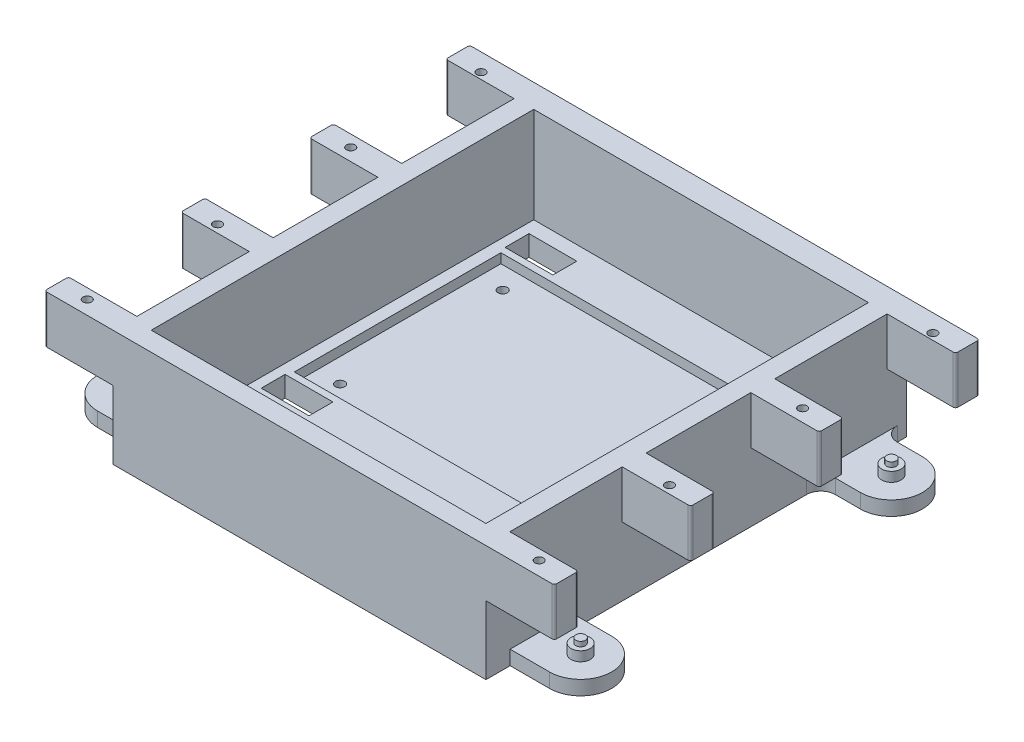
from build123d import *

# Parameters (mm, degrees)
SKETCH_1_W                       = 78
SKETCH_1_H                       = 88
SKETCH_1_W_2                     = 70
SKETCH_1_H_2                     = 80
EXTRUDE_1_DEPTH                  = 10
SKETCH_2_W                       = 78
SKETCH_2_H                       = 88
EXTRUDE_3_DEPTH                  = 14.3
SKETCH_3_W                       = 5
SKETCH_3_H                       = 10
EXTRUDE_4_DEPTH                  = 14.3
PATTERN_LINEAR_2_COUNT           = 2
PATTERN_LINEAR_2_PITCH           = 55.4
MIRROR_3_COPY_1_SKETCH_W         = 5
MIRROR_3_COPY_1_SKETCH_H         = 10
MIRROR_3_COPY_1_DEPTH            = 14.3
SKETCH_7_W                       = 70
SKETCH_7_H                       = 80
CUT_EXTRUDE_1_DEPTH              = 10
EXTRUDE_9_DEPTH                  = 14.3
FILLET_1_R                       = 0.5
CUT_EXTRUDE_2_REACH              = 78.738
SKETCH_13_W                      = 10
SKETCH_13_H                      = 5
EXTRUDE_11_DEPTH                 = 3
SKETCH_14_R                      = 2
EXTRUDE_12_DEPTH                 = 2
SKETCH_15_R                      = 1
EXTRUDE_13_DEPTH                 = 1
PATTERN_LINEAR_3_COUNT           = 2
PATTERN_LINEAR_3_PITCH           = 65
PATTERN_LINEAR_3_COPY_1_DEPTH    = 3
PATTERN_LINEAR_3_COPY_2_SKETCH_R = 2
PATTERN_LINEAR_3_COPY_2_DEPTH    = 2
PATTERN_LINEAR_3_COPY_3_SKETCH_R = 1
PATTERN_LINEAR_3_COPY_3_DEPTH    = 1
SKETCH_16_W                      = 78
SKETCH_16_H                      = 10
EXTRUDE_14_DEPTH                 = 0.9
CUT_EXTRUDE_3_DEPTH              = 2
SKETCH_19_R                      = 0.978239546
CUT_EXTRUDE_4_DEPTH              = 77.349591778
SKETCH_20_W                      = 59.944846142
SKETCH_20_H                      = 43.194920924
CUT_EXTRUDE_5_DEPTH              = 2
FILLET_2_R                       = 3
SKETCH_23_R                      = 0.9
CUT_EXTRUDE_8_DEPTH              = 2


with BuildPart() as part:
    # 草图1 → 凸台-拉伸1 (new body)
    with BuildSketch(Plane(origin=(0, 0, 0), x_dir=(1, 0, 0), z_dir=(0, 1, 0))):
        Rectangle(SKETCH_1_W, SKETCH_1_H)
        Rectangle(SKETCH_1_W_2, SKETCH_1_H_2, mode=Mode.SUBTRACT)
    extrude(amount=EXTRUDE_1_DEPTH)

    # 草图2 → 凸台-拉伸3 (add)
    with BuildSketch(Plane.XZ):
        Rectangle(SKETCH_2_W, SKETCH_2_H)
    extrude(amount=EXTRUDE_3_DEPTH)

    # 草图3 → 凸台-拉伸4 (add)
    with BuildSketch(Plane.ZY.offset(39)):
        with Locations((41.5, 5)):
            Rectangle(SKETCH_3_W, SKETCH_3_H)
        with Locations((13, 5)):
            Rectangle(SKETCH_3_W, SKETCH_3_H)
    extrude_4 = extrude(amount=EXTRUDE_4_DEPTH)

    # 阵列(线性)2: 凸台-拉伸4 ×2
    with Locations(*[(0, 0, -i * PATTERN_LINEAR_2_PITCH) for i in range(1, PATTERN_LINEAR_2_COUNT)]):
        add(extrude_4)

    # 镜向3: 凸台-拉伸4 across plane
    add(extrude_4.mirror(Plane(origin=(0, 0, 0), x_dir=(0, 0, 1), z_dir=(1, 0, 0))))

    # 镜向3 copy 1 sketch → 镜向3 copy 1 (add)
    with BuildSketch(Plane(origin=(39, 0, -55.4), x_dir=(0, 0, 1), z_dir=(1, 0, 0))):
        with Locations((41.5, -5)):
            Rectangle(MIRROR_3_COPY_1_SKETCH_W, MIRROR_3_COPY_1_SKETCH_H)
        with Locations((13, -5)):
            Rectangle(MIRROR_3_COPY_1_SKETCH_W, MIRROR_3_COPY_1_SKETCH_H)
    extrude(amount=MIRROR_3_COPY_1_DEPTH)

    # 草图7 → 切除-拉伸1 (cut)
    with BuildSketch(Plane(origin=(0, 0, 0), x_dir=(1, 0, 0), z_dir=(0, 1, 0))):
        Rectangle(SKETCH_7_W, SKETCH_7_H)
    extrude(amount=-CUT_EXTRUDE_1_DEPTH, mode=Mode.SUBTRACT)

    # 草图12 → 凸台-拉伸9 (add)
    with BuildSketch(Plane.XZ.offset(14.3)):
        Polygon((-39, -44), (0, -49.570884246), (39, -44), align=None)
    extrude(amount=-EXTRUDE_9_DEPTH)

    # 圆角1
    fillet_1_edges = [part.edges().sort_by_distance(p)[0] for p in [
        (53.3, 5, 15.5),
        (53.3, 5, 10.5),
        (53.3, 5, -11.4),
        (53.3, 5, -16.4),
        (53.3, 5, -39.9),
        (53.3, 5, -44.9),
        (-53.3, 5, 44),
        (-53.3, 5, 39),
        (-53.3, 5, 15.5),
        (-53.3, 5, 10.5),
        (-53.3, 5, -11.4),
        (-53.3, 5, -16.4),
        (-53.3, 5, -39.9),
        (-53.3, 5, -44.9),
        (53.3, 5, 44),
        (53.3, 5, 39),
    ]]
    fillet(fillet_1_edges, radius=FILLET_1_R)

    # 草图13 → 切除-拉伸2 (cut, up to next)
    with BuildSketch(Plane.XZ.offset(14.3), mode=Mode.PRIVATE) as cut_extrude_2_sk1:
        with Locations((-28, -34.5)):
            Rectangle(SKETCH_13_W, SKETCH_13_H)
    cut_extrude_2_tool1 = extrude(cut_extrude_2_sk1.sketch, amount=-CUT_EXTRUDE_2_REACH, mode=Mode.PRIVATE) & part.part
    # 草图13 → 切除-拉伸2 (cut, up to next)
    with BuildSketch(Plane.XZ.offset(14.3), mode=Mode.PRIVATE) as cut_extrude_2_sk2:
        with Locations((-28, 16.5)):
            Rectangle(SKETCH_13_W, SKETCH_13_H)
    cut_extrude_2_tool2 = extrude(cut_extrude_2_sk2.sketch, amount=-CUT_EXTRUDE_2_REACH, mode=Mode.PRIVATE) & part.part
    # 草图13 → 切除-拉伸2 (cut, up to next)
    with BuildSketch(Plane.XZ.offset(14.3), mode=Mode.PRIVATE) as cut_extrude_2_sk3:
        with Locations((28, -34.5)):
            Rectangle(SKETCH_13_W, SKETCH_13_H)
    cut_extrude_2_tool3 = extrude(cut_extrude_2_sk3.sketch, amount=-CUT_EXTRUDE_2_REACH, mode=Mode.PRIVATE) & part.part
    # 草图13 → 切除-拉伸2 (cut, up to next)
    with BuildSketch(Plane.XZ.offset(14.3), mode=Mode.PRIVATE) as cut_extrude_2_sk4:
        with Locations((28, 16.5)):
            Rectangle(SKETCH_13_W, SKETCH_13_H)
    cut_extrude_2_tool4 = extrude(cut_extrude_2_sk4.sketch, amount=-CUT_EXTRUDE_2_REACH, mode=Mode.PRIVATE) & part.part
    add(cut_extrude_2_tool1.solids().sort_by_distance((-28, -14.3, -34.5))[0], mode=Mode.SUBTRACT)
    add(cut_extrude_2_tool2.solids().sort_by_distance((-28, -14.3, 16.5))[0], mode=Mode.SUBTRACT)
    add(cut_extrude_2_tool3.solids().sort_by_distance((28, -14.3, -34.5))[0], mode=Mode.SUBTRACT)
    add(cut_extrude_2_tool4.solids().sort_by_distance((28, -14.3, 16.5))[0], mode=Mode.SUBTRACT)

    # 草图8 → 凸台-拉伸11 (add)
    with BuildSketch(Plane.XZ.offset(14.3)):
        with BuildLine():
            Line((47.25, -26.060000002), (39, -26.060000002))
            Line((39, -26.060000002), (39, -38.559799845))
            Line((39, -38.559799845), (39, -39.039999998))
            Line((39, -39.039999998), (47.25, -39.039999998))
            ThreePointArc((47.25, -39.039999998), (53.739999998, -32.55), (47.25, -26.060000002))
        make_face()
    extrude_11 = extrude(amount=-EXTRUDE_11_DEPTH)

    # 草图14 → 凸台-拉伸12 (add)
    with BuildSketch(Plane(origin=(0, -11.3, 0), x_dir=(1, 0, 0), z_dir=(0, 1, 0))):
        with Locations(Location((47.25, 32.55, 0), (0, 0, 90))):
            Circle(SKETCH_14_R)
    extrude_12 = extrude(amount=EXTRUDE_12_DEPTH)

    # 草图15 → 凸台-拉伸13 (add)
    with BuildSketch(Plane(origin=(0, -9.3, 0), x_dir=(1, 0, 0), z_dir=(0, 1, 0))):
        with Locations(Location((47.25, 32.55, 0), (0, 0, 270))):
            Circle(SKETCH_15_R)
    extrude_13 = extrude(amount=EXTRUDE_13_DEPTH)

    # 镜向4: 凸台-拉伸11, 凸台-拉伸12, 凸台-拉伸13 across plane
    add(extrude_11.mirror(Plane(origin=(0, 0, 0), x_dir=(0, 0, 1), z_dir=(1, 0, 0))))
    add(extrude_12.mirror(Plane(origin=(0, 0, 0), x_dir=(0, 0, 1), z_dir=(1, 0, 0))))
    add(extrude_13.mirror(Plane(origin=(0, 0, 0), x_dir=(0, 0, 1), z_dir=(1, 0, 0))))

    # 阵列(线性)3: 凸台-拉伸11, 凸台-拉伸12, 凸台-拉伸13 ×2
    with Locations(*[(0, 0, i * PATTERN_LINEAR_3_PITCH) for i in range(1, PATTERN_LINEAR_3_COUNT)]):
        add(extrude_11)
        add(extrude_12)
        add(extrude_13)

    # 阵列(线性)3 copy 1 sketch → 阵列(线性)3 copy 1 (add)
    with BuildSketch(Plane(origin=(0, -14.3, 65), x_dir=(-1, 0, 0), z_dir=(0, -1, 0))):
        with BuildLine():
            Line((47.25, 26.060000002), (39, 26.060000002))
            Line((39, 26.060000002), (39, 38.559799845))
            Line((39, 38.559799845), (39, 39.039999998))
            Line((39, 39.039999998), (47.25, 39.039999998))
            ThreePointArc((47.25, 39.039999998), (53.739999998, 32.55), (47.25, 26.060000002))
        make_face()
    extrude(amount=-PATTERN_LINEAR_3_COPY_1_DEPTH)

    # 阵列(线性)3 copy 2 sketch → 阵列(线性)3 copy 2 (add)
    with BuildSketch(Plane(origin=(0, -11.3, 65), x_dir=(-1, 0, 0), z_dir=(0, 1, 0))):
        with Locations((47.25, -32.55)):
            Circle(PATTERN_LINEAR_3_COPY_2_SKETCH_R)
    extrude(amount=PATTERN_LINEAR_3_COPY_2_DEPTH)

    # 阵列(线性)3 copy 3 sketch → 阵列(线性)3 copy 3 (add)
    with BuildSketch(Plane(origin=(0, -9.3, 65), x_dir=(-1, 0, 0), z_dir=(0, 1, 0))):
        with Locations((47.25, -32.55)):
            Circle(PATTERN_LINEAR_3_COPY_3_SKETCH_R)
    extrude(amount=PATTERN_LINEAR_3_COPY_3_DEPTH)

    # 草图16 → 凸台-拉伸14 (add)
    with BuildSketch(Plane(origin=(0, 0, -44), x_dir=(-1, 0, 0), z_dir=(0, 0, -1))):
        with Locations((0, 5)):
            Rectangle(SKETCH_16_W, SKETCH_16_H)
    extrude(amount=EXTRUDE_14_DEPTH)

    # 草图18 → 切除-拉伸3 (cut)
    with BuildSketch(Plane(origin=(0, -10, 0), x_dir=(1, 0, 0), z_dir=(0, 1, 0))):
        with BuildLine():
            Line((-31.5, 28), (-31.5, -10))
            ThreePointArc((-31.5, -10), (-30.914213562, -11.414213562), (-29.5, -12))
            Line((-29.5, -12), (24.5, -12))
            ThreePointArc((24.5, -12), (25.914213562, -11.414213562), (26.5, -10))
            Line((26.5, -10), (26.5, 28))
            ThreePointArc((26.5, 28), (25.914213562, 29.414213562), (24.5, 30))
            Line((24.5, 30), (-29.5, 30))
            ThreePointArc((-29.5, 30), (-30.914213562, 29.414213562), (-31.5, 28))
        make_face()
    extrude(amount=-CUT_EXTRUDE_3_DEPTH, mode=Mode.SUBTRACT)

    # 草图19 → 切除-拉伸4 (cut, through all)
    with BuildSketch(Plane(origin=(0, -12, 0), x_dir=(1, 0, 0), z_dir=(0, 1, 0))):
        with Locations(Location((22.5, 26, 0), (0, 0, 270))):
            Circle(SKETCH_19_R)
        with Locations(Location((22.5, -8, 0), (0, 0, 270))):
            Circle(SKETCH_19_R)
        with Locations(Location((-27.5, -8, 0), (0, 0, 270))):
            Circle(SKETCH_19_R)
        with Locations(Location((-27.5, 26, 0), (0, 0, 270))):
            Circle(SKETCH_19_R)
    extrude(amount=-CUT_EXTRUDE_4_DEPTH, mode=Mode.SUBTRACT)

    # 草图20 → 切除-拉伸5 (cut)
    with BuildSketch(Plane(origin=(0, -12, 0), x_dir=(1, 0, 0), z_dir=(0, 1, 0))):
        with Locations((-2.5, 9)):
            Rectangle(SKETCH_20_W, SKETCH_20_H)
    extrude(amount=CUT_EXTRUDE_5_DEPTH, mode=Mode.SUBTRACT)

    # 圆角2
    fillet_2_edges = [part.edges().sort_by_distance(p)[0] for p in [
        (39, -12.8, -39.039999998),
        (39, -12.8, -26.060000002),
        (-39, -12.8, -26.060000002),
        (-39, -12.8, -39.039999998),
        (-39, -12.8, 38.939999998),
        (-39, -12.8, 25.960000002),
    ]]
    fillet(fillet_2_edges, radius=FILLET_2_R)

    # 草图23 → 切除-拉伸8 (cut)
    with BuildSketch(Plane(origin=(0, 10, 0), x_dir=(1, 0, 0), z_dir=(0, 1, 0))):
        with Locations(Location((-47.25, -41.122009123, 0), (0, 0, 270))):
            Circle(SKETCH_23_R)
        with Locations(Location((-47.25, -13.877990877, 0), (0, 0, 270))):
            Circle(SKETCH_23_R)
        with Locations(Location((-47.25, 13.977990877, 0), (0, 0, 270))):
            Circle(SKETCH_23_R)
        with Locations(Location((-47.25, 41.222009123, 0), (0, 0, 270))):
            Circle(SKETCH_23_R)
        with Locations(Location((47.25, -41.122009123, 0), (0, 0, 270))):
            Circle(SKETCH_23_R)
        with Locations(Location((47.25, -13.877990877, 0), (0, 0, 270))):
            Circle(SKETCH_23_R)
        with Locations(Location((47.25, 13.977990877, 0), (0, 0, 270))):
            Circle(SKETCH_23_R)
        with Locations(Location((47.25, 41.222009123, 0), (0, 0, 270))):
            Circle(SKETCH_23_R)
    extrude(amount=-CUT_EXTRUDE_8_DEPTH, mode=Mode.SUBTRACT)


solid = part.part
